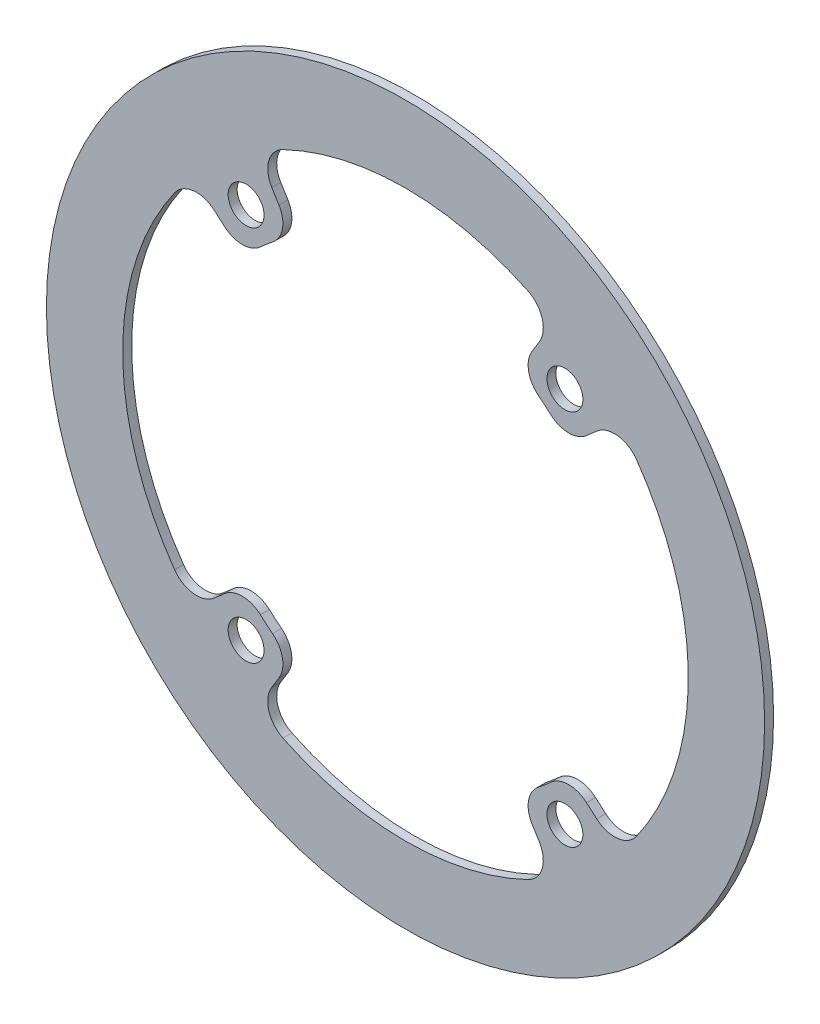
from build123d import *

# Parameters (mm, degrees)
SKETCH_1_R          = 40
SKETCH_1_R_2        = 24
EXTRUDE_1_DEPTH     = 1
SKETCH_2_R          = 2
CUT_EXTRUDE_1_DEPTH = 10
CUT_EXTRUDE_START   = -10
CUT_EXTRUDE_2_DEPTH = 10
FILLET_1_R          = 3


with BuildPart() as part:
    # 草图1 → 凸台-拉伸1 (new body)
    with BuildSketch(Plane.XY):
        Circle(SKETCH_1_R)
        Circle(SKETCH_1_R_2, mode=Mode.SUBTRACT)
    extrude(amount=EXTRUDE_1_DEPTH)

    # 草图2 → 切除-拉伸1 (cut)
    with BuildSketch(Plane.XY.offset(1)):
        with Locations((17.755280905, -21)):
            Circle(SKETCH_2_R)
        with Locations((17.755280905, 21)):
            Circle(SKETCH_2_R)
        with Locations((-17.755280905, -21)):
            Circle(SKETCH_2_R)
        with Locations((-17.755280905, 21)):
            Circle(SKETCH_2_R)
    extrude(amount=-CUT_EXTRUDE_1_DEPTH, mode=Mode.SUBTRACT)

    # 草图3 → 切除-拉伸2 (cut)
    with BuildSketch(Plane.XY.offset(1).offset(CUT_EXTRUDE_START)):
        with BuildLine():
            Line((12.616369605, -20.416346832), (16.558985107, -26.796455218))
            ThreePointArc((16.558985107, -26.796455218), (0, -31.5), (-16.558985107, -26.796455218))
            Line((-16.558985107, -26.796455218), (-12.616369605, -20.416346832))
            ThreePointArc((-12.616369605, -20.416346832), (0, -24), (12.616369605, -20.416346832))
        make_face()
        with BuildLine():
            Line((18.034256384, -15.835580086), (23.669961504, -20.784198863))
            ThreePointArc((23.669961504, -20.784198863), (31.5, 0), (23.669961504, 20.784198863))
            Line((23.669961504, 20.784198863), (18.034256384, 15.835580086))
            ThreePointArc((18.034256384, 15.835580086), (24, 0), (18.034256384, -15.835580086))
        make_face()
        with BuildLine():
            Line((12.616369605, 20.416346832), (16.558985107, 26.796455218))
            ThreePointArc((16.558985107, 26.796455218), (0, 31.5), (-16.558985107, 26.796455218))
            Line((-16.558985107, 26.796455218), (-12.616369605, 20.416346832))
            ThreePointArc((-12.616369605, 20.416346832), (0, 24), (12.616369605, 20.416346832))
        make_face()
        with BuildLine():
            Line((-18.034256384, 15.835580086), (-23.669961504, 20.784198863))
            ThreePointArc((-23.669961504, 20.784198863), (-31.5, 0), (-23.669961504, -20.784198863))
            Line((-23.669961504, -20.784198863), (-18.034256384, -15.835580086))
            ThreePointArc((-18.034256384, -15.835580086), (-24, 0), (-18.034256384, 15.835580086))
        make_face()
    extrude(amount=CUT_EXTRUDE_2_DEPTH, mode=Mode.SUBTRACT)

    # 圆角1
    fillet_1_edges = [part.edges().sort_by_distance(p)[0] for p in [
        (12.616369605, -20.416346832, 0.5),
        (-12.616369605, -20.416346832, 0.5),
        (18.034256384, 15.835580086, 0.5),
        (18.034256384, -15.835580086, 0.5),
        (12.616369605, 20.416346832, 0.5),
        (-12.616369605, 20.416346832, 0.5),
        (-18.034256384, 15.835580086, 0.5),
        (-18.034256384, -15.835580086, 0.5),
        (-23.669961504, -20.784198863, 0.5),
        (-23.669961504, 20.784198863, 0.5),
        (-16.558985107, 26.796455218, 0.5),
        (16.558985107, 26.796455218, 0.5),
        (23.669961504, 20.784198863, 0.5),
        (23.669961504, -20.784198863, 0.5),
        (16.558985107, -26.796455218, 0.5),
        (-16.558985107, -26.796455218, 0.5),
    ]]
    fillet(fillet_1_edges, radius=FILLET_1_R)


solid = part.part
